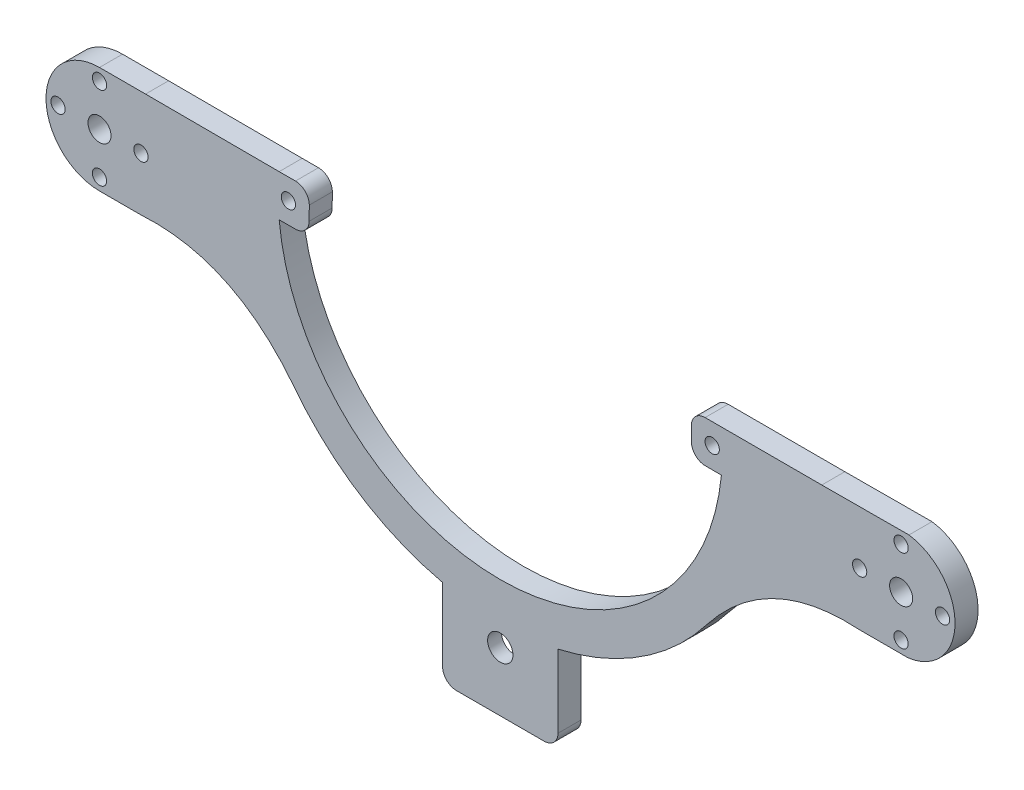
from build123d import *

# Parameters (mm, degrees)
SKETCH2_R           = 1.55
SKETCH2_R_2         = 2.499999997
SKETCH2_R_3         = 2.75
BOSS_EXTRUDE1_DEPTH = 5
CUT_EXTRUDE1_DEPTH  = 2


with BuildPart() as part:
    # Sketch2 → Boss-Extrude1 (new body)
    with BuildSketch(Plane.XY):
        with BuildLine():
            ThreePointArc((-12.525089607, -70.83564173), (-11.646409951, -72.956962073), (-9.525089607, -73.83564173))
            Line((-9.525089607, -73.83564173), (9.525089607, -73.83564173))
            ThreePointArc((9.525089607, -73.83564173), (11.646409951, -72.956962073), (12.525089607, -70.83564173))
            Line((12.525089607, -70.83564173), (12.525089607, -55.009940427))
            ThreePointArc((12.525089607, -55.009940427), (30.521330754, -47.449128385), (44.86389153, -34.208224921))
            add(Edge.make_bspline(
                [(78.006603773, -18.655919566), (58.043406574, -17.372955625), (44.86389153, -34.208224921)],
                knots=[0, 0, 0, 1, 1, 1], degree=2))
            Line((78.006603773, -18.655919566), (88.527931482, -18.655919566))
            ThreePointArc((88.527931482, -18.655919566), (98.717948133, -7.13841292), (88.716103535, 4.542875677))
            Line((88.716103535, 4.542875677), (69.795285346, 4.472063654))
            Line((69.795285346, 4.472063654), (44.465833223, 4.48880334))
            ThreePointArc((44.465833223, 4.48880334), (42.333815881, 3.601374029), (41.463969238, 1.462122864))
            Line((41.463969238, 1.462122864), (41.491086519, -1.586796959))
            ThreePointArc((41.491086519, -1.586796959), (42.375663318, -3.687434951), (44.481277596, -4.560100178))
            Line((44.481277596, -4.560100178), (47.998316287, -4.571460593))
            ThreePointArc((47.998316287, -4.571460593), (0, -48.215522587), (-47.998316287, -4.571460593))
            Line((-47.998316287, -4.571460593), (-44.481277596, -4.560100178))
            ThreePointArc((-44.481277596, -4.560100178), (-42.375663318, -3.687434951), (-41.491086519, -1.586796959))
            Line((-41.491086519, -1.586796959), (-41.463969238, 1.462122864))
            ThreePointArc((-41.463969238, 1.462122864), (-42.333815881, 3.601374029), (-44.465833223, 4.48880334))
            Line((-44.465833223, 4.48880334), (-48.006603773, 4.486463321))
            Line((-48.006603773, 4.486463321), (-77.006603773, 4.569081841))
            Line((-77.006603773, 4.569081841), (-87.006603773, 4.569081841))
            ThreePointArc((-87.006603773, 4.569081841), (-98.619104477, -7.043418862), (-87.006603773, -18.655919566))
            Line((-87.006603773, -18.655919566), (-78.006603773, -18.655919566))
            add(Edge.make_bspline(
                [(-78.006603773, -18.655919566), (-58.043406574, -17.372955625), (-44.86389153, -34.208224921)],
                knots=[0, 0, 0, 1, 1, 1], degree=2))
            ThreePointArc((-44.86389153, -34.208224921), (-30.521330754, -47.449128385), (-12.525089607, -55.009940427))
            Line((-12.525089607, -55.009940427), (-12.525089607, -70.83564173))
        make_face()
        with Locations((-87.006603773, -16.043418862)):
            Circle(SKETCH2_R, mode=Mode.SUBTRACT)
        with Locations((-96.006603773, -7.043418862)):
            Circle(SKETCH2_R, mode=Mode.SUBTRACT)
        with Locations((-87.006603773, -7.043418862)):
            Circle(SKETCH2_R_2, mode=Mode.SUBTRACT)
        with Locations((-78.006603773, -7.043418862)):
            Circle(SKETCH2_R, mode=Mode.SUBTRACT)
        with Locations((-87.006603773, 1.956581138)):
            Circle(SKETCH2_R, mode=Mode.SUBTRACT)
        with Locations((-46, 0)):
            Circle(SKETCH2_R, mode=Mode.SUBTRACT)
        with Locations((87.006603773, -16.043418862)):
            Circle(SKETCH2_R, mode=Mode.SUBTRACT)
        with Locations((46, 0)):
            Circle(SKETCH2_R, mode=Mode.SUBTRACT)
        with Locations((78.006603773, -7.043418862)):
            Circle(SKETCH2_R, mode=Mode.SUBTRACT)
        with Locations((87.006603773, -7.043418862)):
            Circle(SKETCH2_R_2, mode=Mode.SUBTRACT)
        with Locations((96.006603773, -7.043418862)):
            Circle(SKETCH2_R, mode=Mode.SUBTRACT)
        with Locations((87.006603773, 1.956581138)):
            Circle(SKETCH2_R, mode=Mode.SUBTRACT)
        with Locations((0, -61)):
            Circle(SKETCH2_R_3, mode=Mode.SUBTRACT)
    extrude(amount=BOSS_EXTRUDE1_DEPTH)

    # Sketch3 → Cut-Extrude1 (cut)
    with BuildSketch(Plane(origin=(0, 0, 0), x_dir=(-1, 0, 0), z_dir=(0, 0, -1))):
        with BuildLine():
            Line((9.5, -49.5), (-9.5, -49.5))
            ThreePointArc((-9.5, -49.5), (-10.914213562, -50.085786438), (-11.5, -51.5))
            Line((-11.5, -51.5), (-11.5, -70.5))
            ThreePointArc((-11.5, -70.5), (-10.914213562, -71.914213562), (-9.5, -72.5))
            Line((-9.5, -72.5), (9.5, -72.5))
            ThreePointArc((9.5, -72.5), (10.914213562, -71.914213562), (11.5, -70.5))
            Line((11.5, -70.5), (11.5, -51.5))
            ThreePointArc((11.5, -51.5), (10.914213562, -50.085786438), (9.5, -49.5))
        make_face()
    extrude(amount=-CUT_EXTRUDE1_DEPTH, mode=Mode.SUBTRACT)


solid = part.part
